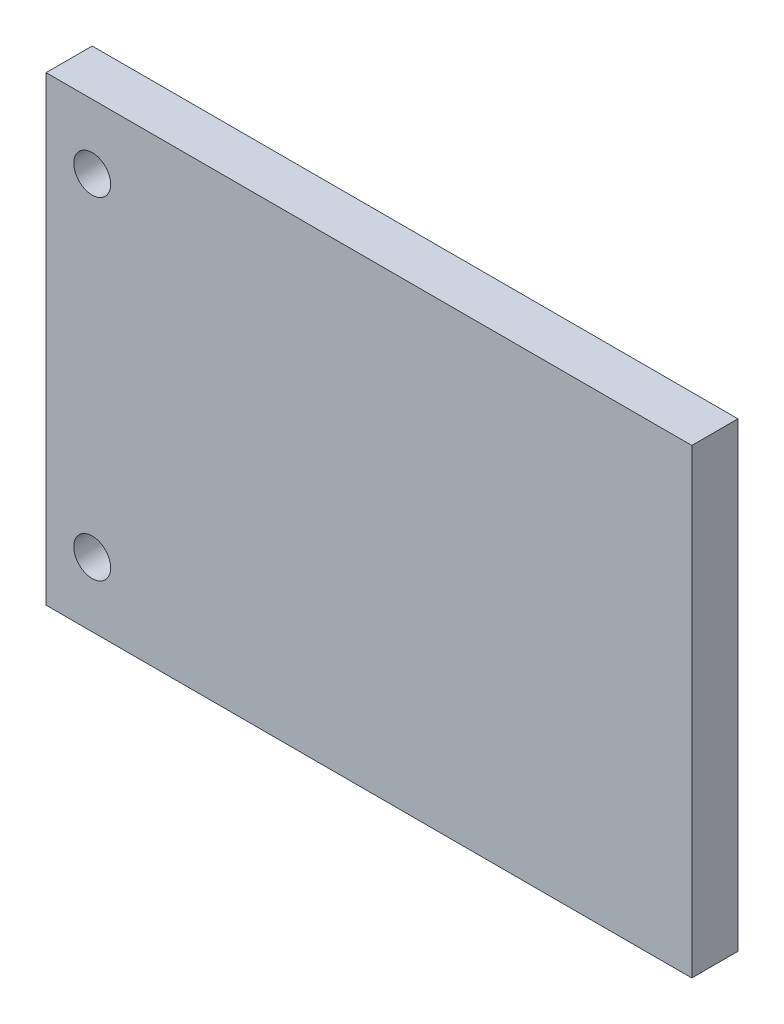
from build123d import *

# Parameters (mm, degrees)
ESQUISSE1_W        = 70
ESQUISSE1_H        = 50
ESQUISSE1_R        = 2
BOSS_EXTRU_1_DEPTH = 5


with BuildPart() as part:
    # Esquisse1 → Boss.-Extru.1 (new body)
    with BuildSketch(Plane.XY):
        Rectangle(ESQUISSE1_W, ESQUISSE1_H)
        with Locations((-30, 18)):
            Circle(ESQUISSE1_R, mode=Mode.SUBTRACT)
        with Locations(Location((-30, -18, 0), (0, 0, 180))):
            Circle(ESQUISSE1_R, mode=Mode.SUBTRACT)
    extrude(amount=BOSS_EXTRU_1_DEPTH)


solid = part.part
